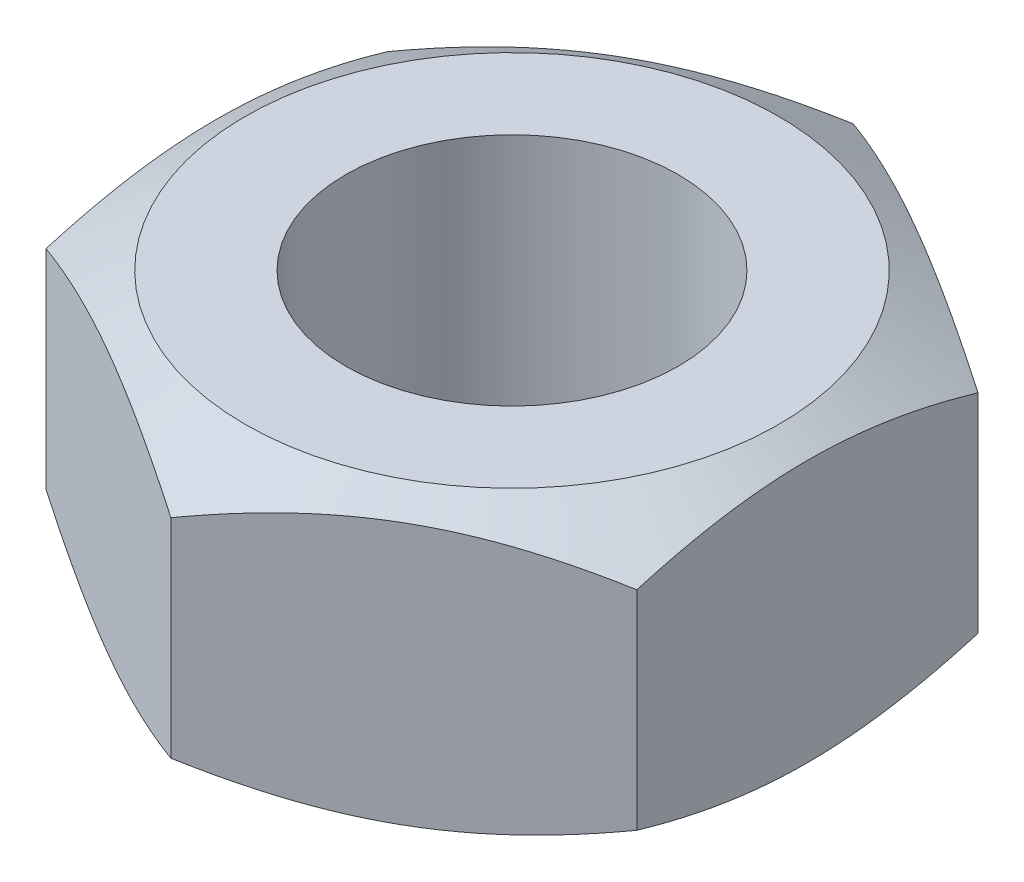
from build123d import *

# Parameters (mm, degrees)
SKETCH1_R           = 2.25
BOSS_EXTRUDE1_DEPTH = 4


with BuildPart() as part:
    # Sketch1 → Boss-Extrude1 (new body)
    with BuildSketch(Plane(origin=(0, 0, 0), x_dir=(1, 0, 0), z_dir=(0, 1, 0))):
        Polygon((0, 4.618802154), (-4, 2.309401077), (-4, -2.309401077), (0, -4.618802154), (4, -2.309401077), (4, 2.309401077), align=None)
        with Locations(Location((0, 0, 0), (0, 0, 270))):
            Circle(SKETCH1_R, mode=Mode.SUBTRACT)
    extrude(amount=BOSS_EXTRUDE1_DEPTH)

    # Sketch2 → Cut-Revolve1 (revolve, cut)
    with BuildSketch(Plane(origin=(0, 0, 0), x_dir=(0, 0, -1), z_dir=(1, 0, 0))):
        Polygon((-5.075475812, 3.142855419), (-2.444726969, 4.683764438), (-4.731695124, 4.838553625), align=None)
        Polygon((-4.731695124, -0.838553625), (-5.075475812, 0.857144581), (-2.444726969, -0.683764438), align=None)
    revolve(axis=Axis((0, 4.212316803, 0), (0, -1, 0)), mode=Mode.SUBTRACT)


solid = part.part
